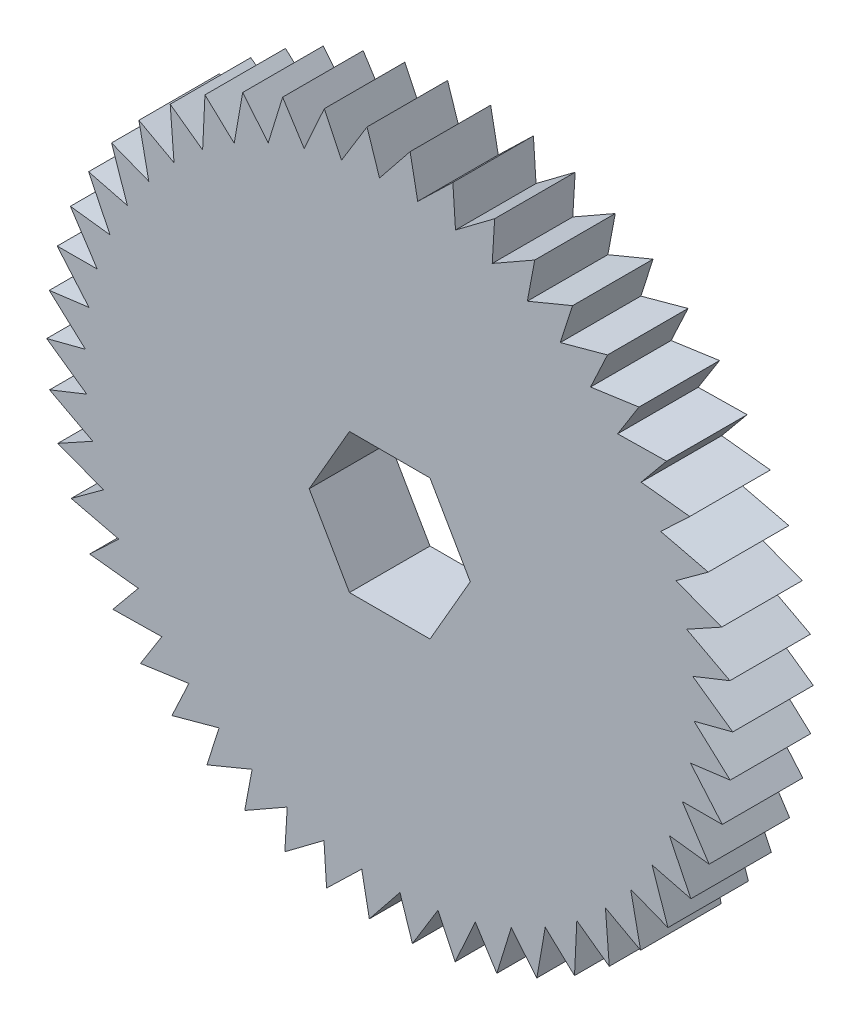
from build123d import *

# Parameters (mm, degrees)
SCHIZZO1_R                    = 42.70134189
ESTRUSIONE_ESTRUSIONE2_DEPTH  = 5
TAGLIO_ESTRUSIONE4_DEPTH      = 62.21118524
TAGLIO_ESTRUSIONE4_DEPTH_BACK = 62.21118524
TAGLIO_ESTRUSIONE5_DEPTH      = 62.21118524
RIPETIZIONECIRCOLARE1_COUNT   = 50


with BuildPart() as part:
    # Schizzo1 → Estrusione-Estrusione2 (new, symmetric)
    with BuildSketch(Plane.XY):
        Circle(SCHIZZO1_R)
    extrude(amount=ESTRUSIONE_ESTRUSIONE2_DEPTH, both=True)

    # Schizzo6 → Taglio-Estrusione4 (cut, two sides: drawn at the far end of the back side and taken through both)
    with BuildSketch(Plane.XY.offset(5).offset(-TAGLIO_ESTRUSIONE4_DEPTH_BACK)):
        Polygon((10, 0), (5, 8.660254038), (-5, 8.660254038), (-10, 0), (-5, -8.660254038), (5, -8.660254038), align=None)
    extrude(amount=TAGLIO_ESTRUSIONE4_DEPTH + TAGLIO_ESTRUSIONE4_DEPTH_BACK, mode=Mode.SUBTRACT)

    # Schizzo7 → Taglio-Estrusione5 (cut, through all)
    with BuildSketch(Plane.XY.offset(5)):
        Polygon((-9.417976615, 44.546082505), (-5.993285857, 37.316179794), (-1.087643203, 45.316179794), align=None)
    taglio_estrusione5 = extrude(amount=-TAGLIO_ESTRUSIONE5_DEPTH, mode=Mode.SUBTRACT)

    # RipetizioneCircolare1: Taglio-Estrusione5 ×50 about axis
    ripetizionecircolare1_axis = Axis((0, 0, 0), (0, 0, 1))
    for i in range(1, RIPETIZIONECIRCOLARE1_COUNT):
        add(taglio_estrusione5.rotate(ripetizionecircolare1_axis, i * 360 / RIPETIZIONECIRCOLARE1_COUNT), mode=Mode.SUBTRACT)


solid = part.part
